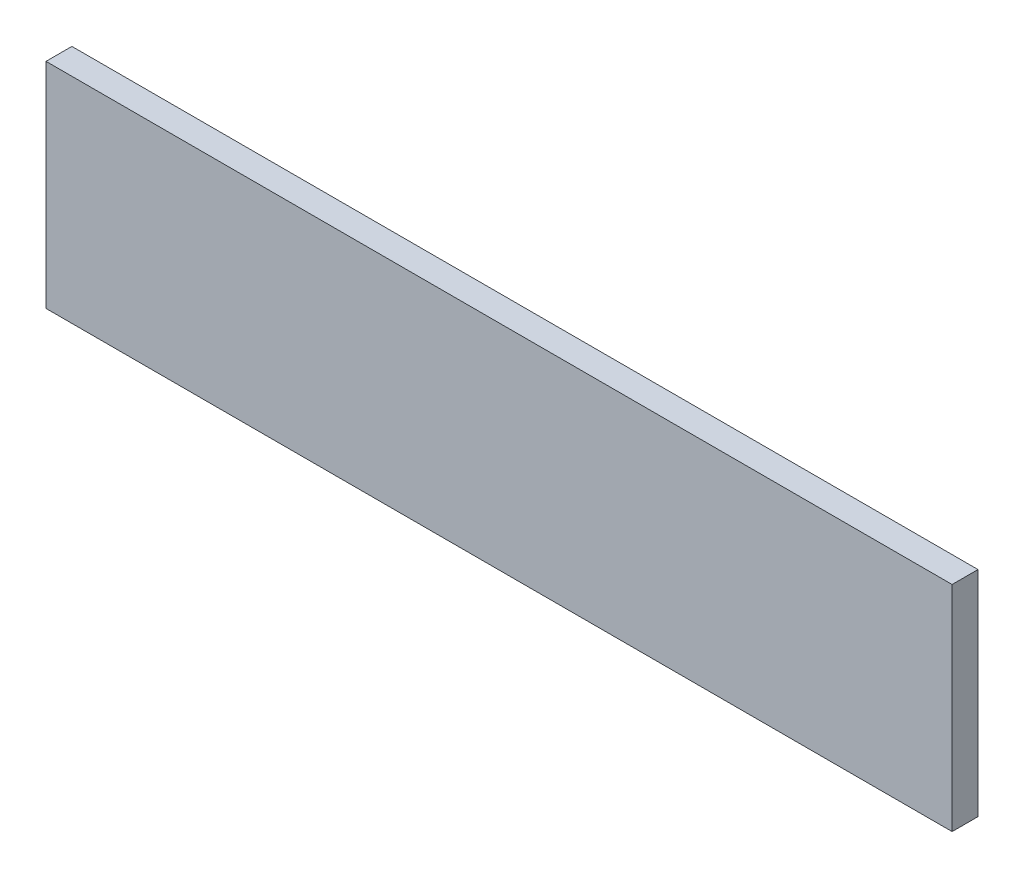
from build123d import *

# Parameters (mm, degrees)
SKETCH1_W           = 3
SKETCH1_H           = 24.8
BOSS_EXTRUDE1_DEPTH = 105


with BuildPart() as part:
    # Sketch1 → Boss-Extrude1 (new body)
    with BuildSketch(Plane(origin=(0, 0, 0), x_dir=(0, 0, -1), z_dir=(1, 0, 0))):
        with Locations((1.5, 12.4)):
            Rectangle(SKETCH1_W, SKETCH1_H)
    extrude(amount=BOSS_EXTRUDE1_DEPTH)


solid = part.part
